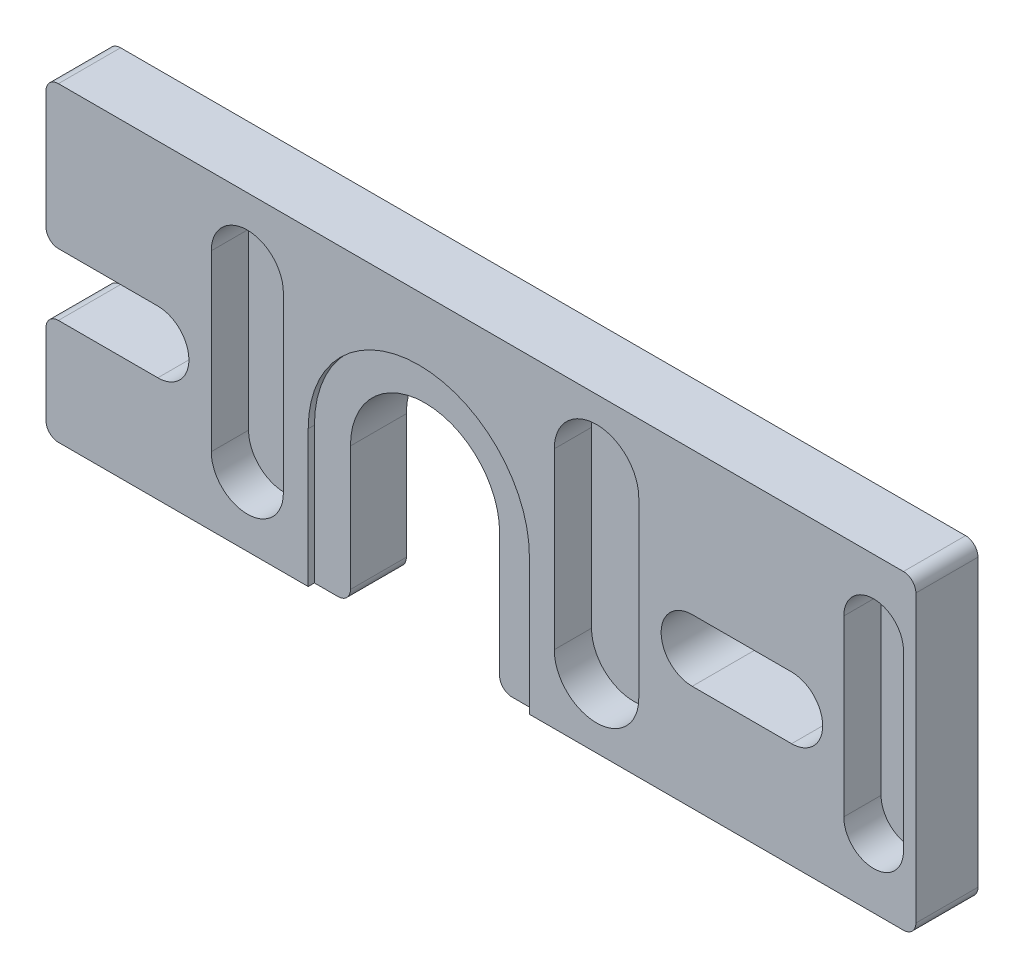
from build123d import *

# Parameters (mm, degrees)
SKETCH1_W           = 70
SKETCH1_H           = 25
BOSS_EXTRUDE1_DEPTH = 5
CUT_EXTRUDE1_DEPTH  = 0.5
CUT_EXTRUDE2_DEPTH  = 75.498322129
CUT_EXTRUDE3_DEPTH  = 75.498322129
CUT_EXTRUDE4_DEPTH  = 75.498322129
CUT_EXTRUDE5_DEPTH  = 3
CUT_EXTRUDE6_DEPTH  = 3
CUT_EXTRUDE7_DEPTH  = 3
FILLET1_R           = 1


with BuildPart() as part:
    # Sketch1 → Boss-Extrude1 (new body)
    with BuildSketch(Plane.XY.offset(5)):
        with Locations((35, 12.5)):
            Rectangle(SKETCH1_W, SKETCH1_H)
    extrude(amount=-BOSS_EXTRUDE1_DEPTH)

    # Sketch2 → Cut-Extrude1 (cut)
    with BuildSketch(Plane.XY.offset(5)):
        with BuildLine():
            Line((38.9, 0), (38.9, 11))
            ThreePointArc((38.9, 11), (30, 19.9), (21.1, 11))
            Line((21.1, 11), (21.1, 0))
            Line((21.1, 0), (38.9, 0))
        make_face()
    extrude(amount=-CUT_EXTRUDE1_DEPTH, mode=Mode.SUBTRACT)

    # Sketch3 → Cut-Extrude2 (cut, through all)
    with BuildSketch(Plane(origin=(0, 0, 0), x_dir=(-1, 0, 0), z_dir=(0, 0, -1))):
        with BuildLine():
            Line((-36, 0), (-24, 0))
            Line((-24, 0), (-24, 11))
            ThreePointArc((-24, 11), (-30, 17), (-36, 11))
            Line((-36, 11), (-36, 0))
        make_face()
    extrude(amount=-CUT_EXTRUDE2_DEPTH, mode=Mode.SUBTRACT)

    # Sketch4 → Cut-Extrude3 (cut, through all)
    with BuildSketch(Plane(origin=(0, 0, 0), x_dir=(-1, 0, 0), z_dir=(0, 0, -1))):
        with BuildLine():
            Line((0, 8.5), (0, 13.5))
            Line((0, 13.5), (-9, 13.5))
            ThreePointArc((-9, 13.5), (-11.5, 11), (-9, 8.5))
            Line((-9, 8.5), (0, 8.5))
        make_face()
    extrude(amount=-CUT_EXTRUDE3_DEPTH, mode=Mode.SUBTRACT)

    # Sketch5 → Cut-Extrude4 (cut, through all)
    with BuildSketch(Plane(origin=(0, 0, 0), x_dir=(-1, 0, 0), z_dir=(0, 0, -1))):
        with BuildLine():
            Line((-52, 13.5), (-60, 13.5))
            ThreePointArc((-60, 13.5), (-62.5, 11), (-60, 8.5))
            Line((-60, 8.5), (-52, 8.5))
            ThreePointArc((-52, 8.5), (-49.5, 11), (-52, 13.5))
        make_face()
    extrude(amount=-CUT_EXTRUDE4_DEPTH, mode=Mode.SUBTRACT)

    # Sketch6 → Cut-Extrude5 (cut)
    with BuildSketch(Plane.XY.offset(5)):
        with BuildLine():
            Line((69, 5.5), (69, 19.5))
            ThreePointArc((69, 19.5), (66.6, 21.9), (64.2, 19.5))
            Line((64.2, 19.5), (64.2, 5.5))
            ThreePointArc((64.2, 5.5), (66.6, 3.1), (69, 5.5))
        make_face()
    extrude(amount=-CUT_EXTRUDE5_DEPTH, mode=Mode.SUBTRACT)

    # Sketch7 → Cut-Extrude6 (cut)
    with BuildSketch(Plane.XY.offset(5)):
        with BuildLine():
            Line((47.7, 5.5), (47.7, 19.5))
            ThreePointArc((47.7, 19.5), (44.3, 22.9), (40.9, 19.5))
            Line((40.9, 19.5), (40.9, 5.5))
            ThreePointArc((40.9, 5.5), (44.3, 2.1), (47.7, 5.5))
        make_face()
    extrude(amount=-CUT_EXTRUDE6_DEPTH, mode=Mode.SUBTRACT)

    # Sketch8 → Cut-Extrude7 (cut)
    with BuildSketch(Plane.XY.offset(5)):
        with BuildLine():
            Line((19.1, 5.5), (19.1, 19.5))
            ThreePointArc((19.1, 19.5), (16.2, 22.4), (13.3, 19.5))
            Line((13.3, 19.5), (13.3, 5.5))
            ThreePointArc((13.3, 5.5), (16.2, 2.6), (19.1, 5.5))
        make_face()
    extrude(amount=-CUT_EXTRUDE7_DEPTH, mode=Mode.SUBTRACT)

    # Fillet1
    fillet1_edges = [part.edges().sort_by_distance(p)[0] for p in [
        (36, 0, 2.25),
        (24, 0, 2.25),
        (0, 8.5, 2.5),
        (0, 13.5, 2.5),
        (70, 25, 2.5),
        (70, 0, 2.5),
        (0, 0, 2.5),
        (0, 25, 2.5),
    ]]
    fillet(fillet1_edges, radius=FILLET1_R)


solid = part.part
